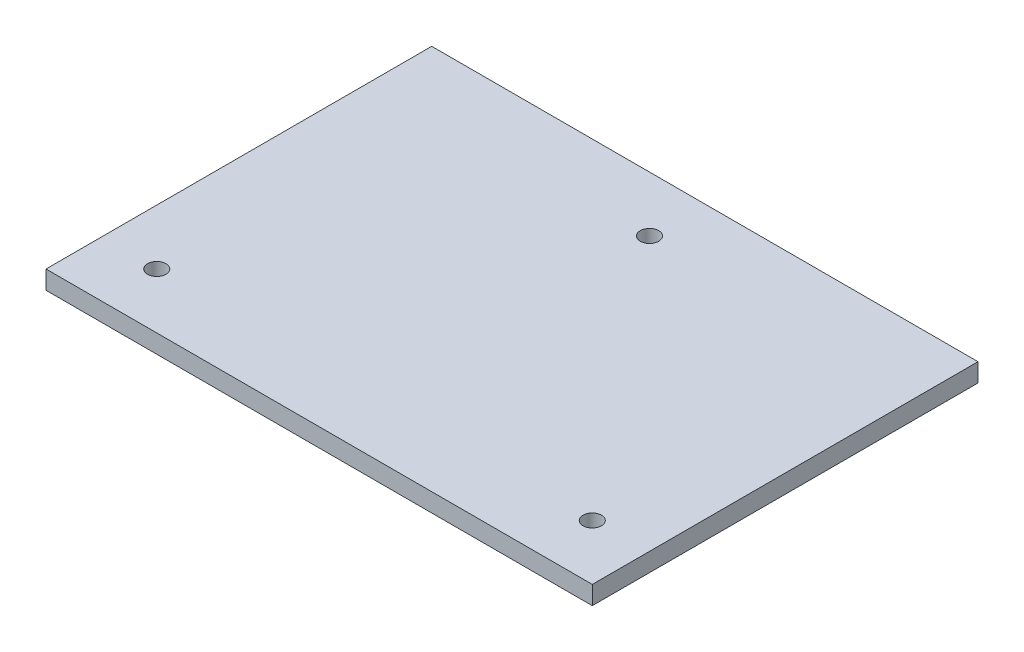
from build123d import *

# Parameters (mm, degrees)
SKETCH1_W          = 296
SKETCH1_H          = 209
EXTRUDE1_DEPTH     = 10
CUT_EXTRUDE1_REACH = 183.45
SKETCH2_R          = 5


with BuildPart() as part:
    # Sketch1 → Extrude1 (new body)
    with BuildSketch(Plane(origin=(0, 0, 0), x_dir=(1, 0, 0), z_dir=(0, 1, 0))):
        Rectangle(SKETCH1_W, SKETCH1_H)
    extrude(amount=EXTRUDE1_DEPTH)

    # Sketch2 → Cut-Extrude1 (cut, up to next)
    with BuildSketch(Plane.XZ, mode=Mode.PRIVATE) as cut_extrude1_sk1:
        with Locations(Location((-118, 74.5, 0), (0, 0, 270))):
            Circle(SKETCH2_R)
    cut_extrude1_tool1 = extrude(cut_extrude1_sk1.sketch, amount=-CUT_EXTRUDE1_REACH, mode=Mode.PRIVATE) & part.part
    # Sketch2 → Cut-Extrude1 (cut, up to next)
    with BuildSketch(Plane.XZ, mode=Mode.PRIVATE) as cut_extrude1_sk2:
        with Locations(Location((118, 74.5, 0), (0, 0, 270))):
            Circle(SKETCH2_R)
    cut_extrude1_tool2 = extrude(cut_extrude1_sk2.sketch, amount=-CUT_EXTRUDE1_REACH, mode=Mode.PRIVATE) & part.part
    # Sketch2 → Cut-Extrude1 (cut, up to next)
    with BuildSketch(Plane.XZ, mode=Mode.PRIVATE) as cut_extrude1_sk3:
        with Locations(Location((0, -74.5, 0), (0, 0, 270))):
            Circle(SKETCH2_R)
    cut_extrude1_tool3 = extrude(cut_extrude1_sk3.sketch, amount=-CUT_EXTRUDE1_REACH, mode=Mode.PRIVATE) & part.part
    add(cut_extrude1_tool1.solids().sort_by_distance((-118, 0, 74.5))[0], mode=Mode.SUBTRACT)
    add(cut_extrude1_tool2.solids().sort_by_distance((118, 0, 74.5))[0], mode=Mode.SUBTRACT)
    add(cut_extrude1_tool3.solids().sort_by_distance((0, 0, -74.5))[0], mode=Mode.SUBTRACT)


solid = part.part
